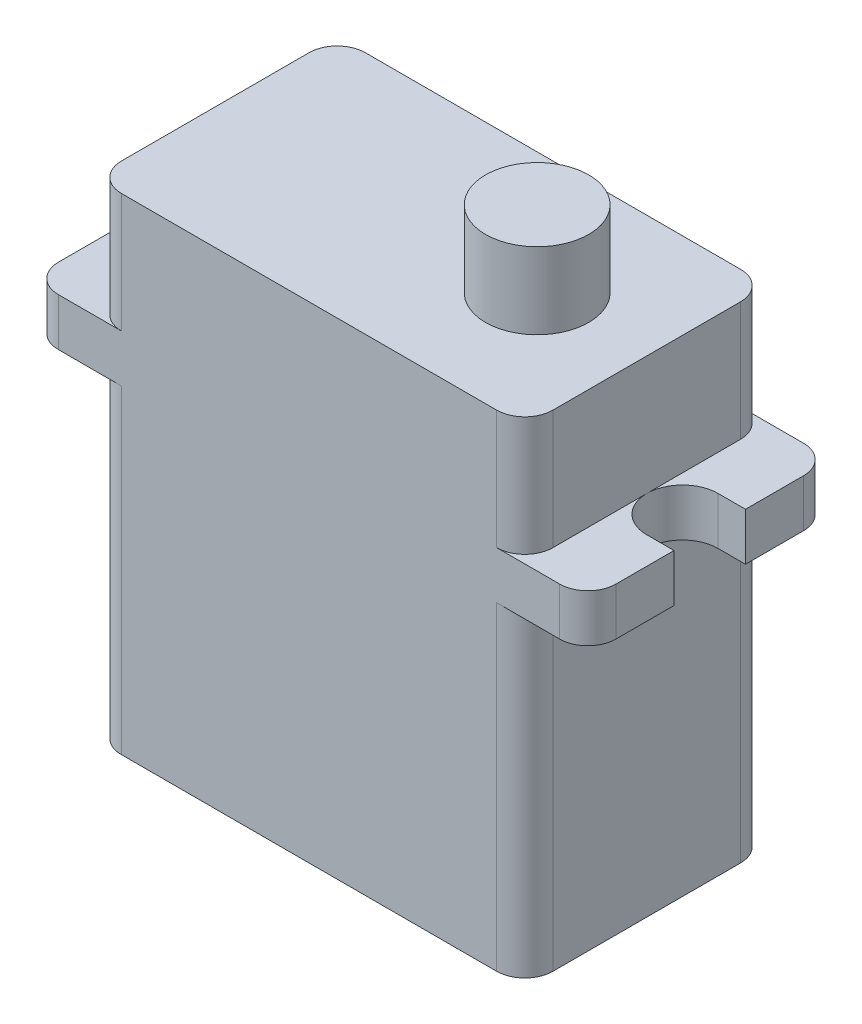
from build123d import *

# Parameters (mm, degrees)
BOSS_EXTRUDE1_DEPTH = 17.018
BOSS_EXTRUDE2_DEPTH = 2.54
BOSS_EXTRUDE3_DEPTH = 6.35
SKETCH4_4_R         = 2.75
BOSS_EXTRUDE4_DEPTH = 10.414


with BuildPart() as part:
    # Sketch2 → Boss-Extrude1 (new body)
    with BuildSketch(Plane(origin=(0, 0, 0), x_dir=(1, 0, 0), z_dir=(0, 1, 0))):
        with BuildLine():
            Line((1.5, 0), (21.5, 0))
            ThreePointArc((21.5, 0), (22.560660172, -0.439339828), (23, -1.5))
            Line((23, -1.5), (23, -11.5))
            ThreePointArc((23, -11.5), (22.560660172, -12.560660172), (21.5, -13))
            Line((21.5, -13), (1.5, -13))
            ThreePointArc((1.5, -13), (0.439339828, -12.560660172), (0, -11.5))
            Line((0, -11.5), (0, -1.5))
            ThreePointArc((0, -1.5), (0.439339828, -0.439339828), (1.5, 0))
        make_face()
    extrude(amount=BOSS_EXTRUDE1_DEPTH)

    # Sketch3 → Boss-Extrude2 (add)
    with BuildSketch(Plane(origin=(0, 17.018, 0), x_dir=(1, 0, 0), z_dir=(0, 1, 0))):
        with BuildLine():
            ThreePointArc((-1.859, 0), (-2.919660172, -0.439339828), (-3.359, -1.5))
            Line((-3.359, -1.5), (-3.359, -4.595))
            Line((-3.359, -4.595), (-1.905, -4.595))
            ThreePointArc((-1.905, -4.595), (0, -6.5), (-1.905, -8.405))
            Line((-1.905, -8.405), (-3.359, -8.405))
            Line((-3.359, -8.405), (-3.359, -11.5))
            ThreePointArc((-3.359, -11.5), (-2.919660172, -12.560660172), (-1.859, -13))
            Line((-1.859, -13), (24.859, -13))
            ThreePointArc((24.859, -13), (25.919660172, -12.560660172), (26.359, -11.5))
            Line((26.359, -11.5), (26.359, -8.405))
            Line((26.359, -8.405), (24.905, -8.405))
            ThreePointArc((24.905, -8.405), (23, -6.5), (24.905, -4.595))
            Line((24.905, -4.595), (26.359, -4.595))
            Line((26.359, -4.595), (26.359, -1.5))
            ThreePointArc((26.359, -1.5), (25.919660172, -0.439339828), (24.859, 0))
            Line((24.859, 0), (-1.859, 0))
        make_face()
    extrude(amount=BOSS_EXTRUDE2_DEPTH)

    # Sketch4 → Boss-Extrude3 (add)
    with BuildSketch(Plane(origin=(0, 19.558, 0), x_dir=(1, 0, 0), z_dir=(0, 1, 0))):
        with BuildLine():
            Line((1.5, 0), (21.5, 0))
            ThreePointArc((21.5, 0), (22.560660172, -0.439339828), (23, -1.5))
            Line((23, -1.5), (23, -11.5))
            ThreePointArc((23, -11.5), (22.560660172, -12.560660172), (21.5, -13))
            Line((21.5, -13), (1.5, -13))
            ThreePointArc((1.5, -13), (0.439339828, -12.560660172), (0, -11.5))
            Line((0, -11.5), (0, -1.5))
            ThreePointArc((0, -1.5), (0.439339828, -0.439339828), (1.5, 0))
        make_face()
    extrude(amount=BOSS_EXTRUDE3_DEPTH)

    # Sketch4<4> → Boss-Extrude4 (add)
    with BuildSketch(Plane(origin=(0, 19.558, 0), x_dir=(1, 0, 0), z_dir=(0, 1, 0))):
        with Locations((17.158, -6.5)):
            Circle(SKETCH4_4_R)
    extrude(amount=BOSS_EXTRUDE4_DEPTH)


solid = part.part
